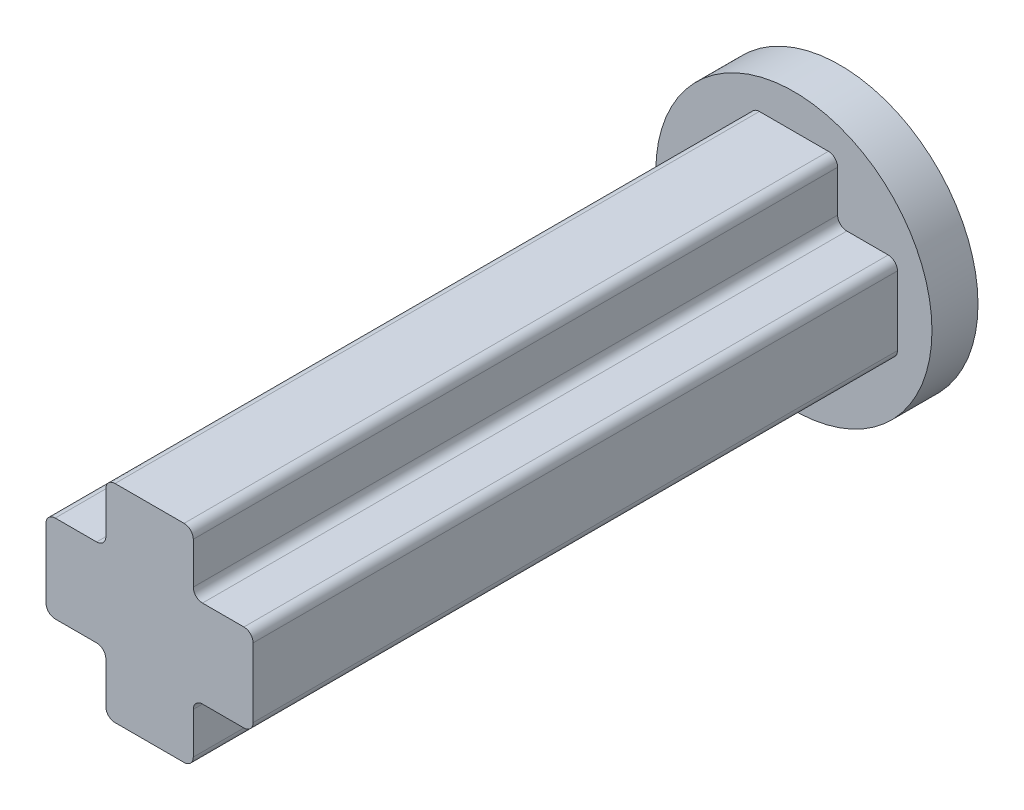
from build123d import *

# Parameters (mm, degrees)
SKETCH1_R           = 3
BOSS_EXTRUDE1_DEPTH = 1
BOSS_EXTRUDE2_DEPTH = 14


with BuildPart() as part:
    # Sketch1 → Boss-Extrude1 (new body)
    with BuildSketch(Plane(origin=(0, 0, 0), x_dir=(0, 1, 0), z_dir=(0, 0, 1))):
        with Locations(Location((0, 0, 0), (0, 0, 270))):
            Circle(SKETCH1_R)
    extrude(amount=BOSS_EXTRUDE1_DEPTH)

    # Sketch2 → Boss-Extrude2 (add)
    with BuildSketch(Plane.XY.offset(1)):
        with BuildLine():
            Line((-0.95, 2.05), (-0.95, 1.15))
            ThreePointArc((-0.95, 1.15), (-1.008578644, 1.008578644), (-1.15, 0.95))
            Line((-1.15, 0.95), (-2.05, 0.95))
            ThreePointArc((-2.05, 0.95), (-2.191421356, 0.891421356), (-2.25, 0.75))
            Line((-2.25, 0.75), (-2.25, -0.75))
            ThreePointArc((-2.25, -0.75), (-2.191421356, -0.891421356), (-2.05, -0.95))
            Line((-2.05, -0.95), (-1.15, -0.95))
            ThreePointArc((-1.15, -0.95), (-1.008578644, -1.008578644), (-0.95, -1.15))
            Line((-0.95, -1.15), (-0.95, -2.05))
            ThreePointArc((-0.95, -2.05), (-0.891421356, -2.191421356), (-0.75, -2.25))
            Line((-0.75, -2.25), (0.75, -2.25))
            ThreePointArc((0.75, -2.25), (0.891421356, -2.191421356), (0.95, -2.05))
            Line((0.95, -2.05), (0.95, -1.15))
            ThreePointArc((0.95, -1.15), (1.008578644, -1.008578644), (1.15, -0.95))
            Line((1.15, -0.95), (2.05, -0.95))
            ThreePointArc((2.05, -0.95), (2.191421356, -0.891421356), (2.25, -0.75))
            Line((2.25, -0.75), (2.25, 0.75))
            ThreePointArc((2.25, 0.75), (2.191421356, 0.891421356), (2.05, 0.95))
            Line((2.05, 0.95), (1.15, 0.95))
            ThreePointArc((1.15, 0.95), (1.008578644, 1.008578644), (0.95, 1.15))
            Line((0.95, 1.15), (0.95, 2.05))
            ThreePointArc((0.95, 2.05), (0.891421356, 2.191421356), (0.75, 2.25))
            Line((0.75, 2.25), (-0.75, 2.25))
            ThreePointArc((-0.75, 2.25), (-0.891421356, 2.191421356), (-0.95, 2.05))
        make_face()
    extrude(amount=BOSS_EXTRUDE2_DEPTH)


solid = part.part
